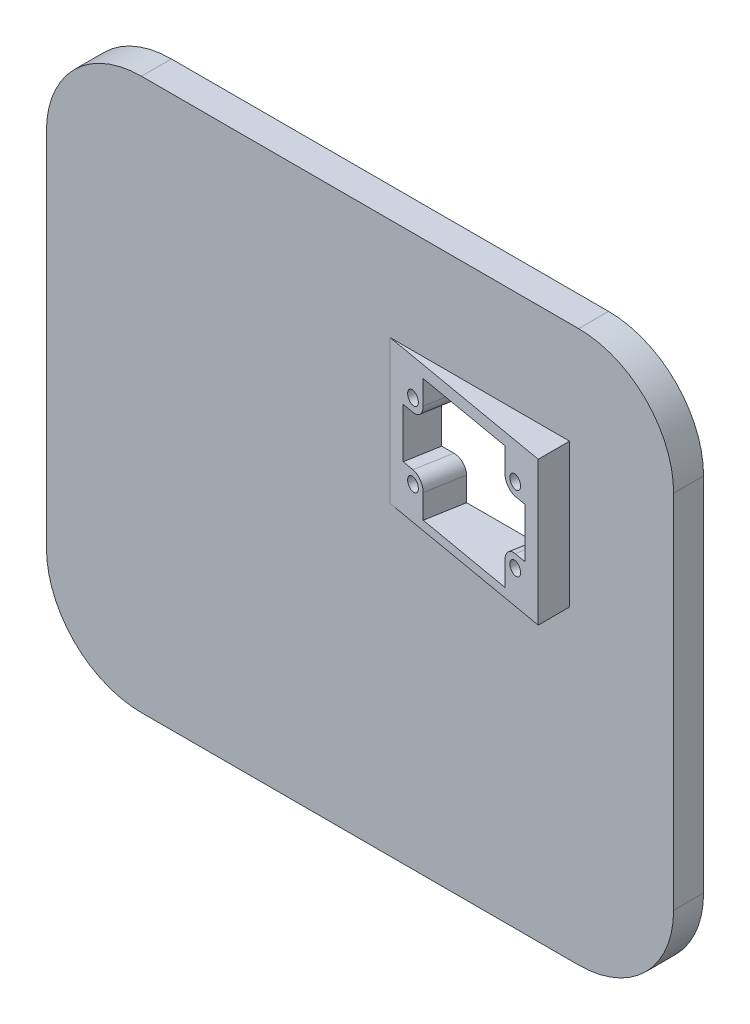
from build123d import *

# Parameters (mm, degrees)
BOSS_EXTRUDE1_DEPTH = 5
BOSS_EXTRUDE2_START = 5
BOSS_EXTRUDE2_DEPTH = 24
SKETCH7_R           = 1.1
CUT_EXTRUDE1_DEPTH  = 71.543483188


with BuildPart() as part:
    # Sketch1 → Boss-Extrude1 (new body)
    with BuildSketch(Plane.XY):
        with BuildLine():
            Line((-36.5125, 46.0375), (36.5125, 46.0375))
            ThreePointArc((36.5125, 46.0375), (47.737820151, 41.387820151), (52.3875, 30.1625))
            Line((52.3875, 30.1625), (52.3875, -30.1625))
            ThreePointArc((52.3875, -30.1625), (47.737820151, -41.387820151), (36.5125, -46.0375))
            Line((36.5125, -46.0375), (-36.5125, -46.0375))
            ThreePointArc((-36.5125, -46.0375), (-47.737820151, -41.387820151), (-52.3875, -30.1625))
            Line((-52.3875, -30.1625), (-52.3875, 30.1625))
            ThreePointArc((-52.3875, 30.1625), (-47.737820151, 41.387820151), (-36.5125, 46.0375))
        make_face()
    extrude(amount=BOSS_EXTRUDE1_DEPTH)

    # Sketch5 → Boss-Extrude2 (add)
    with BuildSketch(Plane(origin=(0, 0, 0), x_dir=(1, 0, 0), z_dir=(0, 1, 0)).offset(BOSS_EXTRUDE2_START)):
        Polygon((5, -5), (35, -10.233130218), (35, -5), align=None)
    extrude(amount=BOSS_EXTRUDE2_DEPTH)

    # Sketch7 → Cut-Extrude1 (cut, through all)
    with BuildSketch(Plane(origin=(-0.698782941, 0, 4.005917559), x_dir=(0.985124383035979, 0, 0.17184280592443155), z_dir=(-0.17184280592443155, 0, 0.985124383035979))):
        with Locations((10.511339581, 23)):
            Circle(SKETCH7_R)
        with Locations(Location((31.511339581, 23, 0), (0, 0, 180))):
            Circle(SKETCH7_R)
        with Locations((31.511339581, 10.5)):
            Circle(SKETCH7_R)
        with Locations(Location((10.511339581, 10.5, 0), (0, 0, 180))):
            Circle(SKETCH7_R)
        with BuildLine():
            Line((29.411339581, 27), (12.611339581, 27))
            Line((12.611339581, 27), (12.611339581, 23))
            ThreePointArc((12.611339581, 23), (11.996263821, 21.51507576), (10.511339581, 20.9))
            Line((10.511339581, 20.9), (8.511339581, 20.9))
            Line((8.511339581, 20.9), (8.511339581, 12.6))
            Line((8.511339581, 12.6), (10.511339581, 12.6))
            ThreePointArc((10.511339581, 12.6), (11.996263821, 11.98492424), (12.611339581, 10.5))
            Line((12.611339581, 10.5), (12.611339581, 6.5))
            Line((12.611339581, 6.5), (29.411339581, 6.5))
            Line((29.411339581, 6.5), (29.411339581, 10.5))
            ThreePointArc((29.411339581, 10.5), (30.02641534, 11.98492424), (31.511339581, 12.6))
            Line((31.511339581, 12.6), (33.511339581, 12.6))
            Line((33.511339581, 12.6), (33.511339581, 20.9))
            Line((33.511339581, 20.9), (31.511339581, 20.9))
            ThreePointArc((31.511339581, 20.9), (30.02641534, 21.51507576), (29.411339581, 23))
            Line((29.411339581, 23), (29.411339581, 27))
        make_face()
    extrude(amount=-CUT_EXTRUDE1_DEPTH, mode=Mode.SUBTRACT)


solid = part.part
